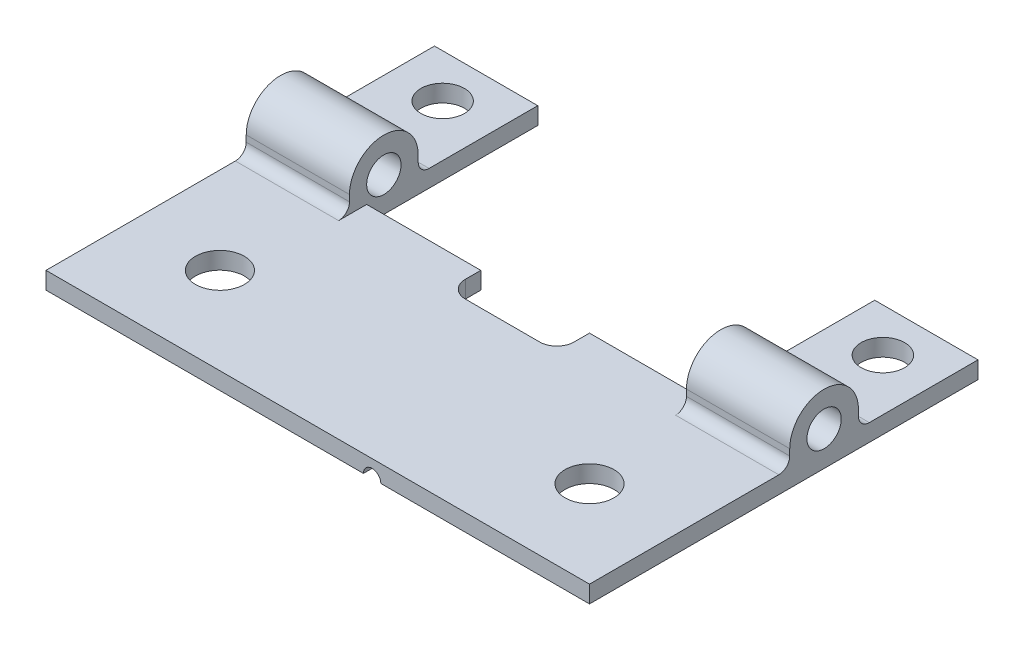
from build123d import *

# Parameters (mm, degrees)
SKETCH1_W                     = 25
SKETCH1_H                     = 10
BASE_PLATE_DEPTH              = 0.79
PINHOLDER_DEPTH               = 4.75
SKETCH4_R                     = 0.79
PIN_SHAFT_DEPTH               = 30.913269547
SKETCH5_R                     = 1.125
SCREW_HOLES_DEPTH             = 4
SKETCH11_R                    = 1
SET_SCREW_HOLE_DEPTH          = 1.5
MIRRORED_FILLETS_R            = 0.5
MIRRORED_FILLETS_OF_MIRROR1_R = 0.5
SKETCH9_RX                    = 0.4
SKETCH9_RY                    = 0.4
SKETCH10_W                    = 5
SKETCH10_H                    = 0.79
SPRING_GROOVE_DEPTH           = 1.5
FILLET2_R                     = 0.79


with BuildPart() as part:
    # Sketch1 → Base Plate (new body)
    with BuildSketch(Plane(origin=(0, 0, 0), x_dir=(1, 0, 0), z_dir=(0, 1, 0))):
        with Locations((1.323198198, 3.248873874)):
            Rectangle(SKETCH1_W, SKETCH1_H)
    extrude(amount=BASE_PLATE_DEPTH)

    # Sketch2 → PinHolder (add)
    with BuildSketch(Plane.ZY.offset(11.176801802)):
        with BuildLine():
            Line((-8.248873874, 0), (-8.248873874, 0.79))
            Line((-8.248873874, 0.79), (-7.458873874, 0.79))
            Line((-7.458873874, 0.79), (-7.458873874, 1.58))
            ThreePointArc((-7.458873874, 1.58), (-9.038873874, 3.16), (-10.618873874, 1.58))
            Line((-10.618873874, 1.58), (-10.618873874, 1.29))
            ThreePointArc((-10.618873874, 1.29), (-10.765320483, 0.936446609), (-11.118873874, 0.79))
            Line((-11.118873874, 0.79), (-16.118873874, 0.79))
            Line((-16.118873874, 0.79), (-16.118873874, 0))
            Line((-16.118873874, 0), (-11.426644498, 0))
            Line((-11.426644498, 0), (-8.248873874, 0))
        make_face()
    pinholder = extrude(amount=-PINHOLDER_DEPTH)

    # Sketch4 → Pin Shaft (cut, through all)
    with BuildSketch(Plane.ZY.offset(11.176801802)):
        with Locations((-9.038873874, 1.58)):
            Circle(SKETCH4_R)
    pin_shaft = extrude(amount=-PIN_SHAFT_DEPTH, mode=Mode.SUBTRACT)

    # Sketch5 → Screw Holes (cut)
    with BuildSketch(Plane(origin=(0, 0.79, 0), x_dir=(1, 0, 0), z_dir=(0, 1, 0))):
        with Locations(Location((-7.176801802, 2.248873874, 0), (0, 0, 270))):
            Circle(SKETCH5_R)
        with Locations(Location((9.823198198, 2.248873874, 0), (0, 0, 270))):
            Circle(SKETCH5_R)
    extrude(amount=-SCREW_HOLES_DEPTH, mode=Mode.SUBTRACT)

    # Sketch11 → Set Screw Hole (cut)
    with BuildSketch(Plane(origin=(0, 0.79, 0), x_dir=(1, 0, 0), z_dir=(0, 1, 0))):
        with Locations(Location((-8.801801802, 14.118873874, 0), (0, 0, 270))):
            Circle(SKETCH11_R)
    set_screw_hole = extrude(amount=-SET_SCREW_HOLE_DEPTH, mode=Mode.SUBTRACT)

    # Mirrored Fillets
    mirrored_fillets_edges = [part.edges().sort_by_distance(p)[0] for p in [
        (-8.801801802, 0.79, -7.458873874),
    ]]
    fillet(mirrored_fillets_edges, radius=MIRRORED_FILLETS_R)

    # Mirror1: PinHolder, Pin Shaft, Set Screw Hole across plane
    add(pinholder.mirror(Plane(origin=(1.323198198, 0, 0), x_dir=(0, 0, 1), z_dir=(1, 0, 0))))
    add(pin_shaft.mirror(Plane(origin=(1.323198198, 0, 0), x_dir=(0, 0, 1), z_dir=(1, 0, 0))), mode=Mode.SUBTRACT)
    add(set_screw_hole.mirror(Plane(origin=(1.323198198, 0, 0), x_dir=(0, 0, 1), z_dir=(1, 0, 0))), mode=Mode.SUBTRACT)

    # Mirrored Fillets of Mirror1
    mirrored_fillets_of_mirror1_edges = [part.edges().sort_by_distance(p)[0] for p in [
        (11.448198198, 0.79, -7.458873874),
    ]]
    fillet(mirrored_fillets_of_mirror1_edges, radius=MIRRORED_FILLETS_OF_MIRROR1_R)

    # Wire Groove: sweep along a path in Sketch8
    with BuildLine(Plane.XZ) as wire_groove_path:
        Line((3.823198198, -8.248873874), (3.823198198, 1.751126126))
    # Sketch9 → Wire Groove (sweep, cut)
    with BuildSketch(Plane.XY.offset(1.751126126)):
        with Locations((3.823198198, 0)):
            Ellipse(SKETCH9_RX, SKETCH9_RY)
    sweep(path=wire_groove_path.line, mode=Mode.SUBTRACT)

    # Sketch10 → Spring Groove (cut)
    with BuildSketch(Plane(origin=(0, 0, -8.248873874), x_dir=(-1, 0, 0), z_dir=(0, 0, -1))):
        with Locations((-1.323198198, 0.395)):
            Rectangle(SKETCH10_W, SKETCH10_H)
    extrude(amount=-SPRING_GROOVE_DEPTH, mode=Mode.SUBTRACT)

    # Fillet2
    fillet2_edges = [part.edges().sort_by_distance(p)[0] for p in [
        (-1.176801802, 0.395, -6.748873874),
        (3.823198198, 0.595, -6.748873874),
    ]]
    fillet(fillet2_edges, radius=FILLET2_R)


solid = part.part
